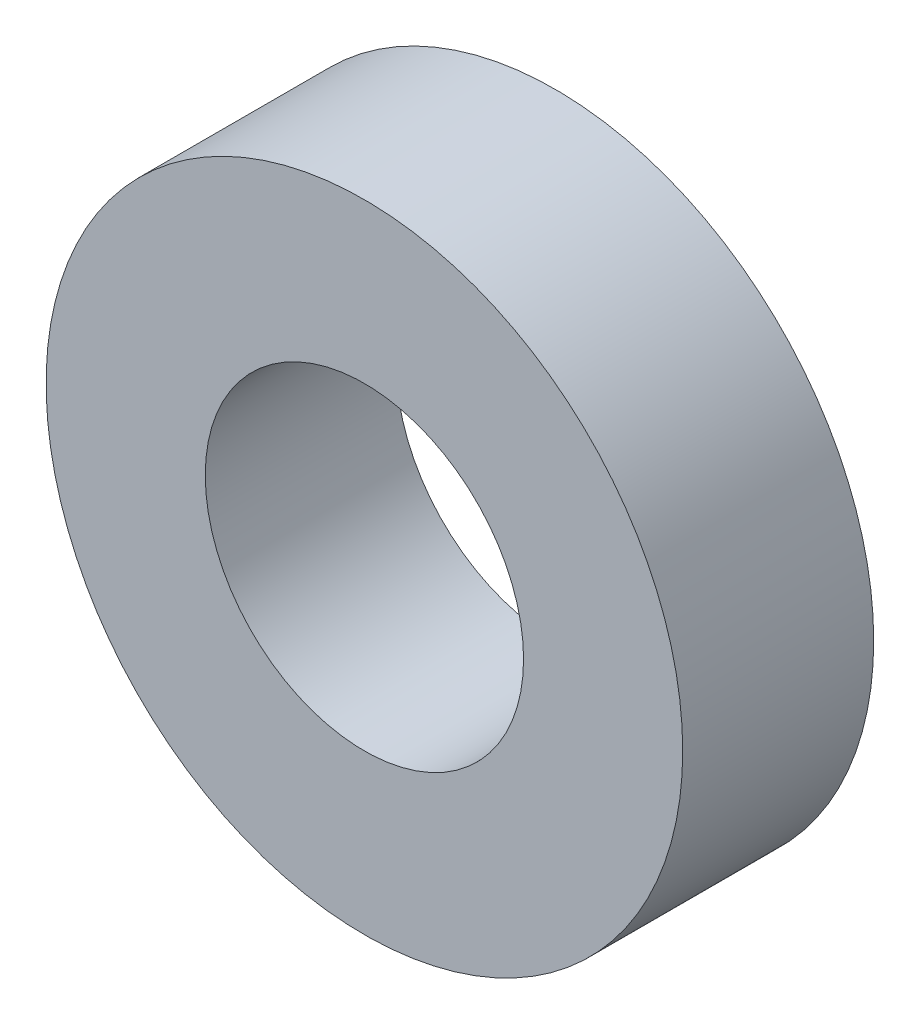
from build123d import *

# Parameters (mm, degrees)
ESBO_O1_R                = 5
ESBO_O1_R_2              = 2.5
RESSALTO_EXTRUS_O1_DEPTH = 3


with BuildPart() as part:
    # Esboço1 → Ressalto-extrusão1 (new body)
    with BuildSketch(Plane.XY):
        with Locations((-23, 23)):
            Circle(ESBO_O1_R)
        with Locations((-23, 23)):
            Circle(ESBO_O1_R_2, mode=Mode.SUBTRACT)
    extrude(amount=RESSALTO_EXTRUS_O1_DEPTH)


solid = part.part
